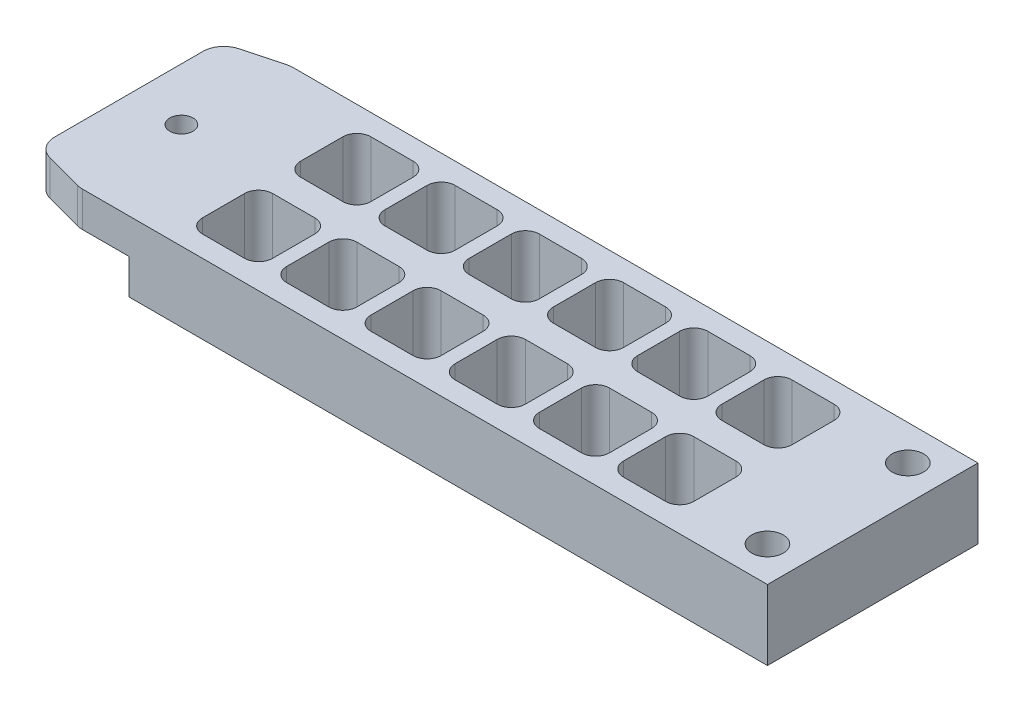
from build123d import *

# Parameters (mm, degrees)
EXTRUDE_1_DEPTH     = 10
SKETCH_4_W          = 15
SKETCH_4_H          = 30
CUT_EXTRUDE_2_DEPTH = 5
FILLET_1_R          = 3
CUT_EXTRUDE_3_DEPTH = 111.616454472
HOLE_WIZARD_M41_D   = 4.5
M4X0_71_D           = 3.3


with BuildPart() as part:
    # Эскиз1 → Бобышка-Вытянуть1 (new body)
    with BuildSketch(Plane(origin=(0, 0, 0), x_dir=(1, 0, 0), z_dir=(0, 1, 0))):
        Polygon((15, 0), (106, 0), (106, 30), (15, 30), (8, 30), (0, 27.856406461), (0, 2.143593539), (8, 0), align=None)
    extrude(amount=EXTRUDE_1_DEPTH)

    # Эскиз4 → Вырез-Вытянуть2 (cut)
    with BuildSketch(Plane.XZ):
        with Locations((7.5, -15)):
            Rectangle(SKETCH_4_W, SKETCH_4_H)
    extrude(amount=-CUT_EXTRUDE_2_DEPTH, mode=Mode.SUBTRACT)

    # Скругление1
    fillet_1_edges = [part.edges().sort_by_distance(p)[0] for p in [
        (8, 7.5, 0),
        (0, 7.5, -2.143593539),
        (0, 7.5, -27.856406461),
        (8, 7.5, -30),
    ]]
    fillet(fillet_1_edges, radius=FILLET_1_R)

    # Эскиз5 → Вырез-Вытянуть3 (cut, through all)
    with BuildSketch(Plane.XZ):
        with BuildLine():
            Line((22.5, -17), (28.5, -17))
            ThreePointArc((28.5, -17), (29.914213562, -17.585786438), (30.5, -19))
            Line((30.5, -19), (30.5, -25))
            ThreePointArc((30.5, -25), (29.914213562, -26.414213562), (28.5, -27))
            Line((28.5, -27), (22.5, -27))
            ThreePointArc((22.5, -27), (21.085786438, -26.414213562), (20.5, -25))
            Line((20.5, -25), (20.5, -19))
            ThreePointArc((20.5, -19), (21.085786438, -17.585786438), (22.5, -17))
        make_face()
        with BuildLine():
            Line((34.5, -17), (40.5, -17))
            ThreePointArc((40.5, -17), (41.914213562, -17.585786438), (42.5, -19))
            Line((42.5, -19), (42.5, -25))
            ThreePointArc((42.5, -25), (41.914213562, -26.414213562), (40.5, -27))
            Line((40.5, -27), (34.5, -27))
            ThreePointArc((34.5, -27), (33.085786438, -26.414213562), (32.5, -25))
            Line((32.5, -25), (32.5, -19))
            ThreePointArc((32.5, -19), (33.085786438, -17.585786438), (34.5, -17))
        make_face()
        with BuildLine():
            Line((46.5, -17), (52.5, -17))
            ThreePointArc((52.5, -17), (53.914213562, -17.585786438), (54.5, -19))
            Line((54.5, -19), (54.5, -25))
            ThreePointArc((54.5, -25), (53.914213562, -26.414213562), (52.5, -27))
            Line((52.5, -27), (46.5, -27))
            ThreePointArc((46.5, -27), (45.085786438, -26.414213562), (44.5, -25))
            Line((44.5, -25), (44.5, -19))
            ThreePointArc((44.5, -19), (45.085786438, -17.585786438), (46.5, -17))
        make_face()
        with BuildLine():
            Line((58.5, -17), (64.5, -17))
            ThreePointArc((64.5, -17), (65.914213562, -17.585786438), (66.5, -19))
            Line((66.5, -19), (66.5, -25))
            ThreePointArc((66.5, -25), (65.914213562, -26.414213562), (64.5, -27))
            Line((64.5, -27), (58.5, -27))
            ThreePointArc((58.5, -27), (57.085786438, -26.414213562), (56.5, -25))
            Line((56.5, -25), (56.5, -19))
            ThreePointArc((56.5, -19), (57.085786438, -17.585786438), (58.5, -17))
        make_face()
        with BuildLine():
            Line((70.5, -17), (76.5, -17))
            ThreePointArc((76.5, -17), (77.914213562, -17.585786438), (78.5, -19))
            Line((78.5, -19), (78.5, -25))
            ThreePointArc((78.5, -25), (77.914213562, -26.414213562), (76.5, -27))
            Line((76.5, -27), (70.5, -27))
            ThreePointArc((70.5, -27), (69.085786438, -26.414213562), (68.5, -25))
            Line((68.5, -25), (68.5, -19))
            ThreePointArc((68.5, -19), (69.085786438, -17.585786438), (70.5, -17))
        make_face()
        with BuildLine():
            Line((82.5, -17), (88.5, -17))
            ThreePointArc((88.5, -17), (89.914213562, -17.585786438), (90.5, -19))
            Line((90.5, -19), (90.5, -25))
            ThreePointArc((90.5, -25), (89.914213562, -26.414213562), (88.5, -27))
            Line((88.5, -27), (82.5, -27))
            ThreePointArc((82.5, -27), (81.085786438, -26.414213562), (80.5, -25))
            Line((80.5, -25), (80.5, -19))
            ThreePointArc((80.5, -19), (81.085786438, -17.585786438), (82.5, -17))
        make_face()
        with BuildLine():
            Line((90.5, -11), (90.5, -5))
            ThreePointArc((90.5, -5), (89.914213562, -3.585786438), (88.5, -3))
            Line((88.5, -3), (82.5, -3))
            ThreePointArc((82.5, -3), (81.085786438, -3.585786438), (80.5, -5))
            Line((80.5, -5), (80.5, -11))
            ThreePointArc((80.5, -11), (81.085786438, -12.414213562), (82.5, -13))
            Line((82.5, -13), (88.5, -13))
            ThreePointArc((88.5, -13), (89.914213562, -12.414213562), (90.5, -11))
        make_face()
        with BuildLine():
            Line((78.5, -11), (78.5, -5))
            ThreePointArc((78.5, -5), (77.914213562, -3.585786438), (76.5, -3))
            Line((76.5, -3), (70.5, -3))
            ThreePointArc((70.5, -3), (69.085786438, -3.585786438), (68.5, -5))
            Line((68.5, -5), (68.5, -11))
            ThreePointArc((68.5, -11), (69.085786438, -12.414213562), (70.5, -13))
            Line((70.5, -13), (76.5, -13))
            ThreePointArc((76.5, -13), (77.914213562, -12.414213562), (78.5, -11))
        make_face()
        with BuildLine():
            Line((66.5, -11), (66.5, -5))
            ThreePointArc((66.5, -5), (65.914213562, -3.585786438), (64.5, -3))
            Line((64.5, -3), (58.5, -3))
            ThreePointArc((58.5, -3), (57.085786438, -3.585786438), (56.5, -5))
            Line((56.5, -5), (56.5, -11))
            ThreePointArc((56.5, -11), (57.085786438, -12.414213562), (58.5, -13))
            Line((58.5, -13), (64.5, -13))
            ThreePointArc((64.5, -13), (65.914213562, -12.414213562), (66.5, -11))
        make_face()
        with BuildLine():
            Line((54.5, -11), (54.5, -5))
            ThreePointArc((54.5, -5), (53.914213562, -3.585786438), (52.5, -3))
            Line((52.5, -3), (46.5, -3))
            ThreePointArc((46.5, -3), (45.085786438, -3.585786438), (44.5, -5))
            Line((44.5, -5), (44.5, -11))
            ThreePointArc((44.5, -11), (45.085786438, -12.414213562), (46.5, -13))
            Line((46.5, -13), (52.5, -13))
            ThreePointArc((52.5, -13), (53.914213562, -12.414213562), (54.5, -11))
        make_face()
        with BuildLine():
            Line((42.5, -11), (42.5, -5))
            ThreePointArc((42.5, -5), (41.914213562, -3.585786438), (40.5, -3))
            Line((40.5, -3), (34.5, -3))
            ThreePointArc((34.5, -3), (33.085786438, -3.585786438), (32.5, -5))
            Line((32.5, -5), (32.5, -11))
            ThreePointArc((32.5, -11), (33.085786438, -12.414213562), (34.5, -13))
            Line((34.5, -13), (40.5, -13))
            ThreePointArc((40.5, -13), (41.914213562, -12.414213562), (42.5, -11))
        make_face()
        with BuildLine():
            Line((30.5, -11), (30.5, -5))
            ThreePointArc((30.5, -5), (29.914213562, -3.585786438), (28.5, -3))
            Line((28.5, -3), (22.5, -3))
            ThreePointArc((22.5, -3), (21.085786438, -3.585786438), (20.5, -5))
            Line((20.5, -5), (20.5, -11))
            ThreePointArc((20.5, -11), (21.085786438, -12.414213562), (22.5, -13))
            Line((22.5, -13), (28.5, -13))
            ThreePointArc((28.5, -13), (29.914213562, -12.414213562), (30.5, -11))
        make_face()
    extrude(amount=-CUT_EXTRUDE_3_DEPTH, mode=Mode.SUBTRACT)

    # Отверстие с зазором M41 (through all)
    with Locations(Plane(origin=(0, 10, 0), x_dir=(1, 0, 0), z_dir=(0, 1, 0))):
        with Locations((101, 25), (101, 5)):
            Hole(HOLE_WIZARD_M41_D / 2)

    # Отверстие обработанное метчиком M4x0.71 (through all)
    with Locations(Plane(origin=(0, 5, 0), x_dir=(-1, 0, 0), z_dir=(0, -1, 0))):
        with Locations((-7.5, 15)):
            Hole(M4X0_71_D / 2)


solid = part.part
